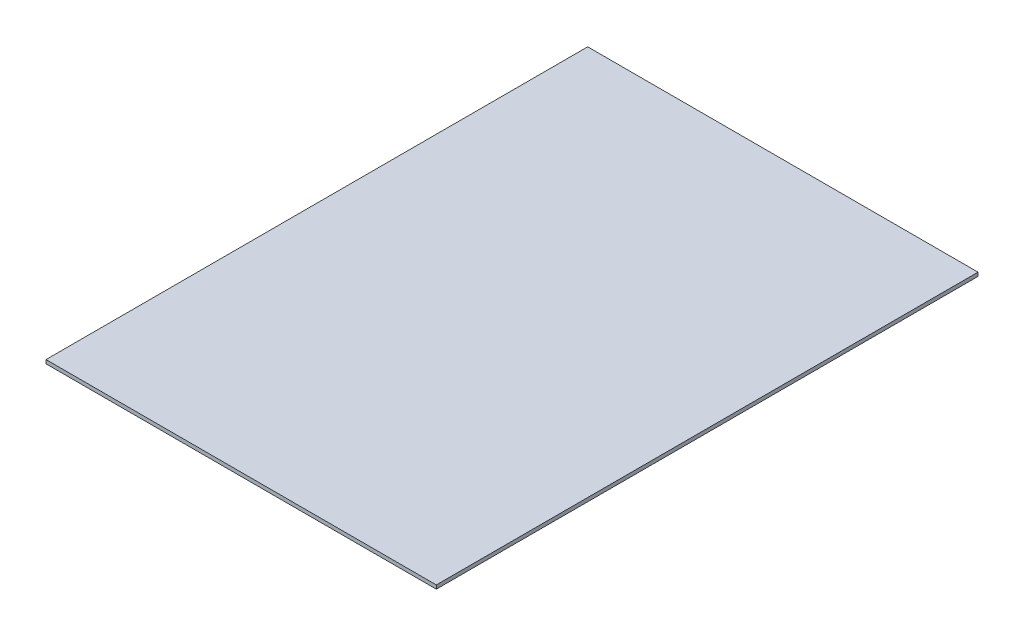
from build123d import *

# Parameters (mm, degrees)
SKETCH1_W           = 133.66
SKETCH1_H           = 185.5
BOSS_EXTRUDE1_DEPTH = 0.635


with BuildPart() as part:
    # Sketch1 → Boss-Extrude1 (new, symmetric)
    with BuildSketch(Plane(origin=(0, 0, 0), x_dir=(1, 0, 0), z_dir=(0, 1, 0))):
        Rectangle(SKETCH1_W, SKETCH1_H)
    extrude(amount=BOSS_EXTRUDE1_DEPTH, both=True)


solid = part.part
